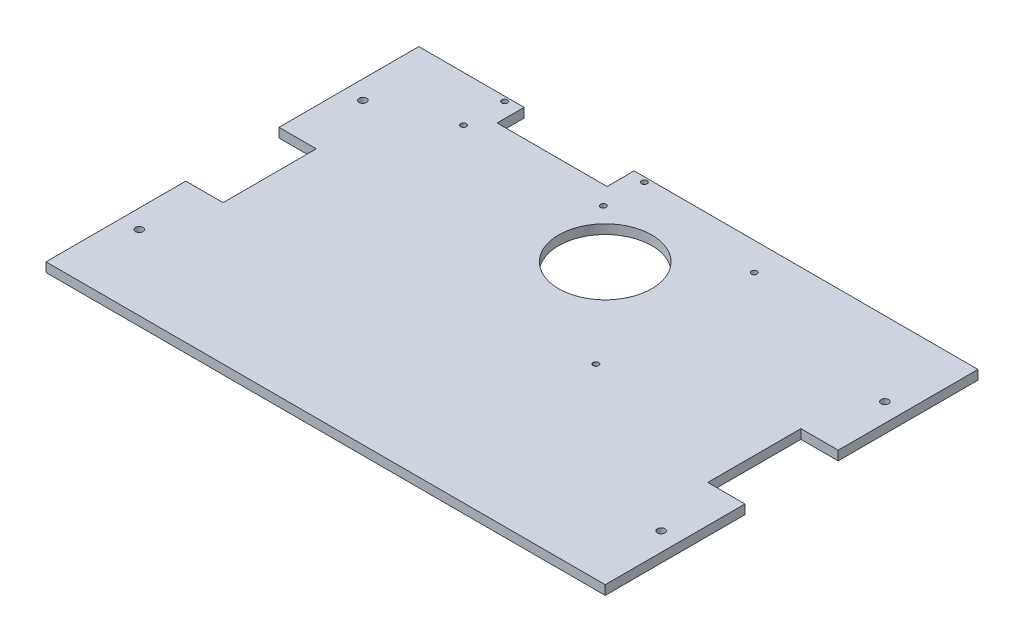
from build123d import *

# Parameters (mm, degrees)
SKETCH1_W           = 300
SKETCH1_H           = 200
BOSS_EXTRUDE1_DEPTH = 5
SKETCH2_R           = 2
SKETCH2_R_2         = 25
CUT_EXTRUDE2_DEPTH  = 181.346887969
SKETCH4_R           = 1.5
CUT_EXTRUDE3_DEPTH  = 181.346887969
SKETCH6_W           = 59
SKETCH6_H           = 14.5
CUT_EXTRUDE4_DEPTH  = 5
SKETCH8_R           = 1.5
CUT_EXTRUDE6_DEPTH  = 181.346887969
SKETCH9_W           = 20
SKETCH9_H           = 50
CUT_EXTRUDE7_DEPTH  = 181.346887969


with BuildPart() as part:
    # Sketch1 → Boss-Extrude1 (new body)
    with BuildSketch(Plane(origin=(0, 0, 0), x_dir=(1, 0, 0), z_dir=(0, 1, 0))):
        Rectangle(SKETCH1_W, SKETCH1_H)
    extrude(amount=BOSS_EXTRUDE1_DEPTH)

    # Sketch2 → Cut-Extrude2 (cut, through all)
    with BuildSketch(Plane(origin=(0, 5, 0), x_dir=(1, 0, 0), z_dir=(0, 1, 0))):
        with Locations(Location((-140, 0, 0), (0, 0, 270))):
            Circle(SKETCH2_R)
        with Locations(Location((-140, 60, 0), (0, 0, 270))):
            Circle(SKETCH2_R)
        with Locations(Location((-140, -60, 0), (0, 0, 90))):
            Circle(SKETCH2_R)
        with Locations(Location((140, -60, 0), (0, 0, 270))):
            Circle(SKETCH2_R)
        with Locations(Location((140, 60, 0), (0, 0, 90))):
            Circle(SKETCH2_R)
        with Locations(Location((140, 0, 0), (0, 0, 90))):
            Circle(SKETCH2_R)
        with Locations(Location((0, 50, 0), (0, 0, 270))):
            Circle(SKETCH2_R_2)
    extrude(amount=-CUT_EXTRUDE2_DEPTH, mode=Mode.SUBTRACT)

    # Sketch4 → Cut-Extrude3 (cut, through all)
    with BuildSketch(Plane(origin=(0, 5, 0), x_dir=(1, 0, 0), z_dir=(0, 1, 0))):
        with Locations(Location((-101.5, 97.5, 0), (0, 0, 270))):
            Circle(SKETCH4_R)
        with Locations(Location((-26.5, 97.5, 0), (0, 0, 270))):
            Circle(SKETCH4_R)
        with Locations(Location((-26.5, 75.5, 0), (0, 0, 270))):
            Circle(SKETCH4_R)
        with Locations(Location((-101.5, 75.5, 0), (0, 0, 270))):
            Circle(SKETCH4_R)
    extrude(amount=-CUT_EXTRUDE3_DEPTH, mode=Mode.SUBTRACT)

    # Sketch6 → Cut-Extrude4 (cut)
    with BuildSketch(Plane.XZ):
        with Locations((-64, -92.75)):
            Rectangle(SKETCH6_W, SKETCH6_H)
    extrude(amount=-CUT_EXTRUDE4_DEPTH, mode=Mode.SUBTRACT)

    # Sketch8 → Cut-Extrude6 (cut, through all)
    with BuildSketch(Plane(origin=(0, 5, 0), x_dir=(1, 0, 0), z_dir=(0, 1, 0))):
        with Locations(Location((45, 85, 0), (0, 0, 270))):
            Circle(SKETCH8_R)
        with Locations(Location((45, 0, 0), (0, 0, 270))):
            Circle(SKETCH8_R)
    extrude(amount=-CUT_EXTRUDE6_DEPTH, mode=Mode.SUBTRACT)

    # Sketch9 → Cut-Extrude7 (cut, through all)
    with BuildSketch(Plane(origin=(0, 5, 0), x_dir=(1, 0, 0), z_dir=(0, 1, 0))):
        with Locations((-140, 0)):
            Rectangle(SKETCH9_W, SKETCH9_H)
        with Locations((140, 0)):
            Rectangle(SKETCH9_W, SKETCH9_H)
    extrude(amount=-CUT_EXTRUDE7_DEPTH, mode=Mode.SUBTRACT)


solid = part.part
